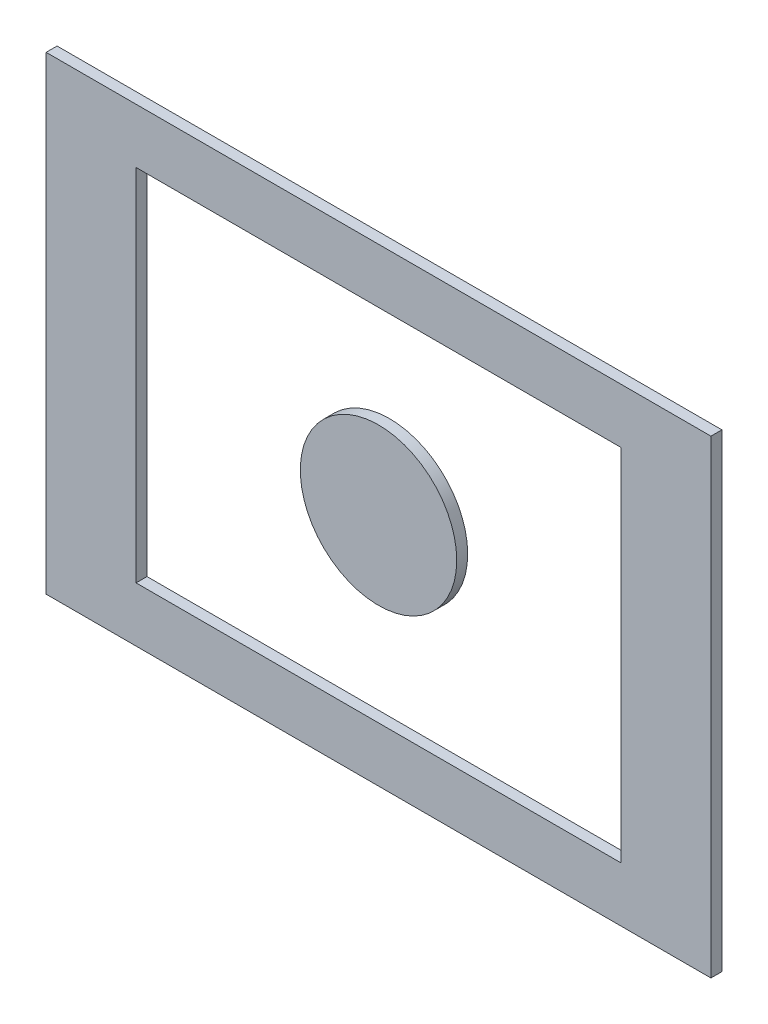
from build123d import *

# Parameters (mm, degrees)
SKETCH_1_W      = 85
SKETCH_1_H      = 60
SKETCH_1_W_2    = 62
SKETCH_1_H_2    = 46
EXTRUDE_1_DEPTH = 1.4
SKETCH_2_R      = 10
EXTRUDE_2_DEPTH = 1.4


with BuildPart() as part:
    # 草图1 → 凸台-拉伸1 (new body)
    with BuildSketch(Plane.XY):
        Rectangle(SKETCH_1_W, SKETCH_1_H)
        Rectangle(SKETCH_1_W_2, SKETCH_1_H_2, mode=Mode.SUBTRACT)
    extrude(amount=EXTRUDE_1_DEPTH)


with BuildPart() as body_2:
    # 草图2 → 凸台-拉伸2 (new body)
    with BuildSketch(Plane.XY.offset(1.4)):
        Circle(SKETCH_2_R)
    extrude(amount=-EXTRUDE_2_DEPTH)


solid = Compound([part.part, body_2.part])
